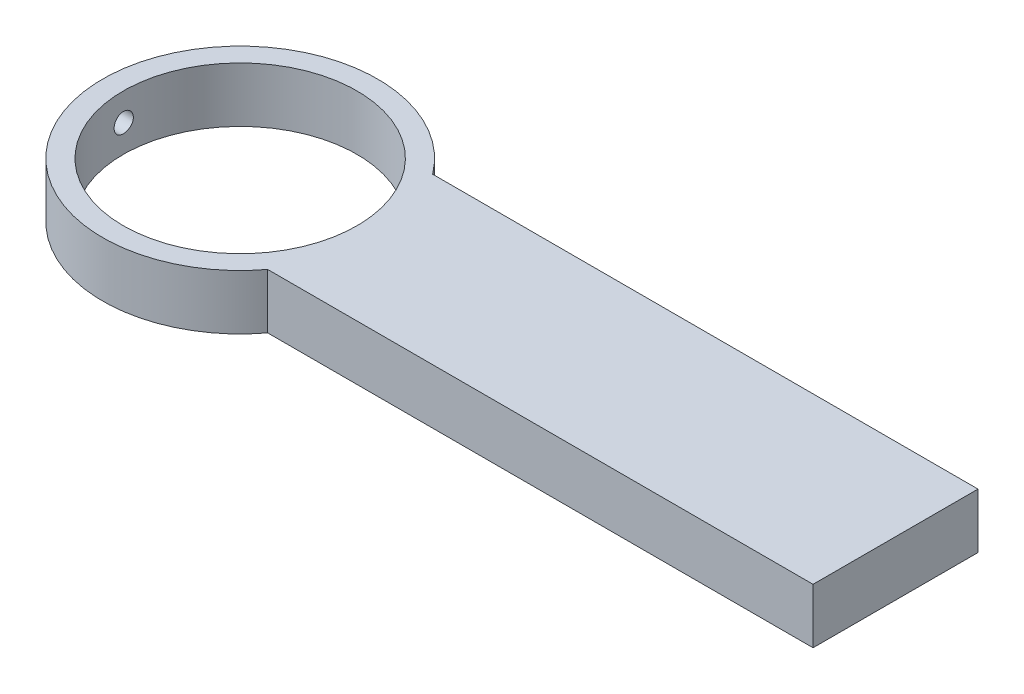
from build123d import *

# Parameters (mm, degrees)
BOSS_EXTRUDE1_DEPTH      = 10
BOSS_EXTRUDE1_DEPTH_BACK = 10
SKETCH1_R                = 42.5
CUT_EXTRUDE6_REACH       = 194.75
CUT_EXTRUDE6_END_RADIUS  = 42.5
SKETCH3_R                = 3.5


with BuildPart() as part:
    # Sketch1 → Boss-Extrude1 (new, two sides: drawn at the far end of the back side and taken through both)
    with BuildSketch(Plane(origin=(0, 0, 0), x_dir=(1, 0, 0), z_dir=(0, 1, 0)).offset(-BOSS_EXTRUDE1_DEPTH_BACK)):
        with BuildLine():
            ThreePointArc((40, 30), (-50, 0), (40, -30))
            Line((40, -30), (238.383087675, -30))
            Line((238.383087675, -30), (238.383087675, 30))
            Line((238.383087675, 30), (40, 30))
        make_face()
        Circle(SKETCH1_R, mode=Mode.SUBTRACT)
    extrude(amount=BOSS_EXTRUDE1_DEPTH + BOSS_EXTRUDE1_DEPTH_BACK)

    # Cut-Extrude6: up to this cylinder (the profile starts outside it)
    cut_extrude6_end = Plane(origin=(0, 0, 0), z_dir=(0, 1, 0)) * Cylinder(CUT_EXTRUDE6_END_RADIUS, 475.5, mode=Mode.PRIVATE)
    # Sketch3 → Cut-Extrude6 (cut, up to the surface)
    with BuildSketch(Plane.ZY.offset(-52.5), mode=Mode.PRIVATE) as cut_extrude6_sk1:
        Circle(SKETCH3_R)
    cut_extrude6_tool1 = extrude(cut_extrude6_sk1.sketch, amount=CUT_EXTRUDE6_REACH, mode=Mode.PRIVATE) - cut_extrude6_end
    cut_extrude6 = cut_extrude6_tool1.solids().sort_by_distance((52.5, 0, 0))[0]
    add(cut_extrude6, mode=Mode.SUBTRACT)

    # Mirror1: Cut-Extrude6 across plane
    add(cut_extrude6.mirror(Plane(origin=(0, 0, 0), x_dir=(0, 0, 1), z_dir=(1, 0, 0))), mode=Mode.SUBTRACT)


solid = part.part
